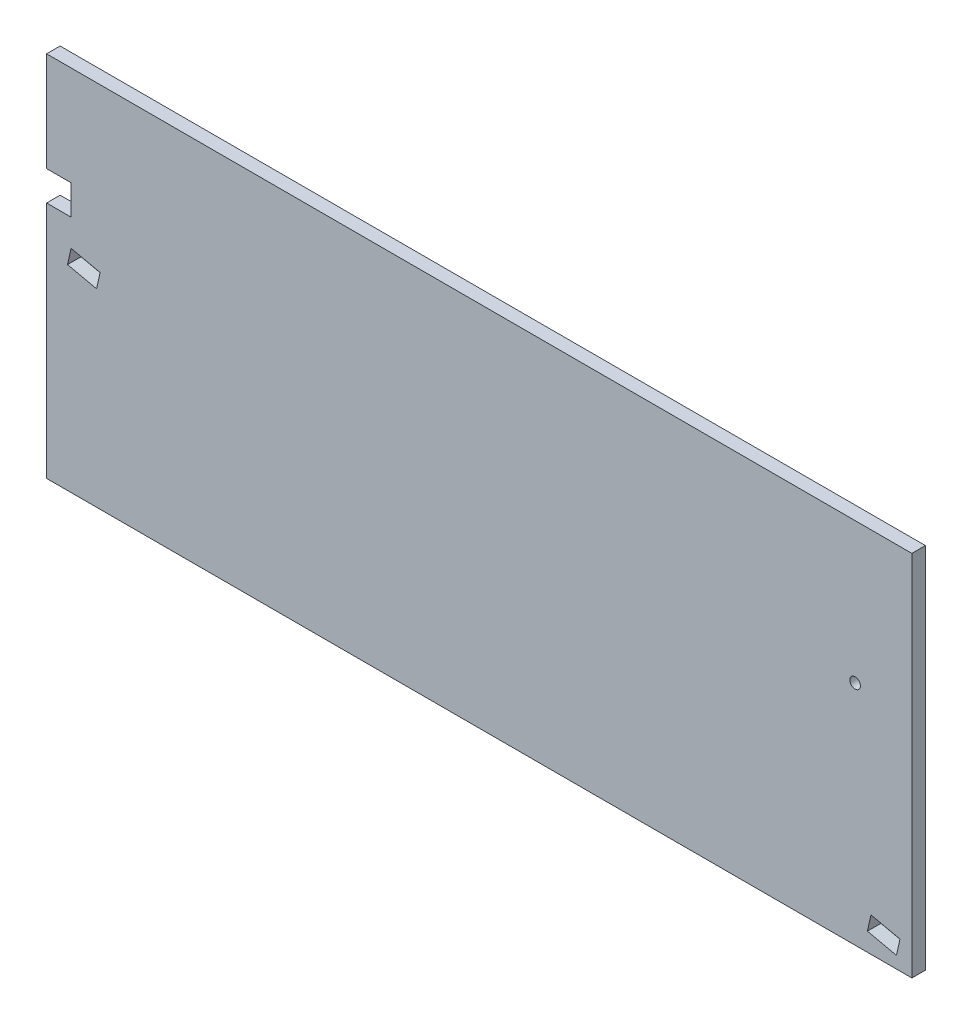
from build123d import *

# Parameters (mm, degrees)
SKETCH1_W           = 203.2
SKETCH1_H           = 86.36
SKETCH1_R           = 1.25
BOSS_EXTRUDE1_DEPTH = 3.175
CUT_EXTRUDE1_DEPTH  = 134.381746221
LPATTERN1_COUNT     = 2
LPATTERN1_PITCH     = 192.405
SKETCH4_W           = 5.74233914
SKETCH4_H           = 6.985
CUT_EXTRUDE2_DEPTH  = 134.381746221


with BuildPart() as part:
    # Sketch1 → Boss-Extrude1 (new body)
    with BuildSketch(Plane.XY):
        with Locations((0, 43.18)):
            Rectangle(SKETCH1_W, SKETCH1_H)
        with Locations((88.265, 53.34)):
            Circle(SKETCH1_R, mode=Mode.SUBTRACT)
    extrude(amount=BOSS_EXTRUDE1_DEPTH)

    # Sketch3 → Cut-Extrude1 (cut, through all)
    with BuildSketch(Plane.XY.offset(3.175)):
        Polygon((91.98657239, 8.02551849), (91.161937461, 4.305830703), (97.981365071, 2.794), (98.806, 6.513687787), align=None)
    cut_extrude1 = extrude(amount=-CUT_EXTRUDE1_DEPTH, mode=Mode.SUBTRACT)

    # LPattern1: Cut-Extrude1 ×2
    with Locations(*[Vector(-0.9762960071199333, 0.21643961393810354, 0) * (i * LPATTERN1_PITCH) for i in range(1, LPATTERN1_COUNT)]):
        add(cut_extrude1, mode=Mode.SUBTRACT)

    # Sketch4 → Cut-Extrude2 (cut, through all)
    with BuildSketch(Plane.XY.offset(3.175)):
        with Locations((-98.72883043, 59.51208241)):
            Rectangle(SKETCH4_W, SKETCH4_H)
    extrude(amount=-CUT_EXTRUDE2_DEPTH, mode=Mode.SUBTRACT)


solid = part.part
